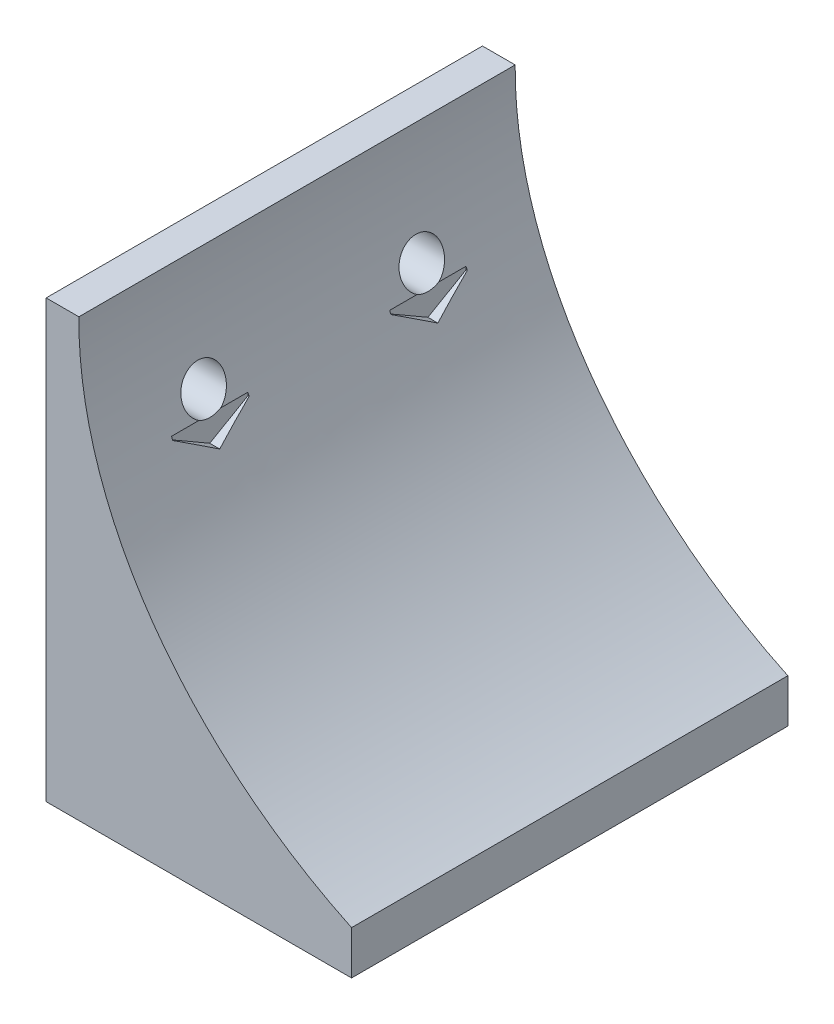
from build123d import *

# Parameters (mm, degrees)
EXTRUDE_1_DEPTH     = 20
SKETCH_2_R          = 2
CUT_EXTRUDE_2_DEPTH = 10
CUT_EXTRUDE_3_DEPTH = 20


with BuildPart() as part:
    # 草图1 → 凸台-拉伸1 (new, symmetric)
    with BuildSketch(Plane.XY):
        with BuildLine():
            Line((0, 40), (0, 0))
            Line((0, 0), (28, 0))
            Line((28, 0), (28, 4))
            add(Edge.make_bspline(
                [(28, 4), (14.27041689, 10.491058619), (2.887307451, 23.83674366), (3, 40)],
                knots=[0, 0, 0, 0, 1, 1, 1, 1], degree=3))
            Line((3, 40), (0, 40))
        make_face()
    extrude(amount=EXTRUDE_1_DEPTH, both=True)

    # 草图2 → 切除-拉伸2 (cut, symmetric)
    with BuildSketch(Plane(origin=(0, 0, 0), x_dir=(0, 0, -1), z_dir=(1, 0, 0))):
        with Locations((-10, 30)):
            Circle(SKETCH_2_R)
        with Locations((10, 30)):
            Circle(SKETCH_2_R)
    extrude(amount=CUT_EXTRUDE_2_DEPTH, both=True, mode=Mode.SUBTRACT)

    # 草图3 → 切除-拉伸3 (cut)
    with BuildSketch(Plane(origin=(5, 0, 0), x_dir=(0, 0, -1), z_dir=(1, 0, 0))):
        Polygon((-10, 34.041451884), (-13.5, 32.020725942), (-13.5, 27.979274058), (-10, 25.958548116), (-6.5, 27.979274058), (-6.5, 32.020725942), align=None)
        Polygon((10, 34.041451884), (6.5, 32.020725942), (6.5, 27.979274058), (10, 25.958548116), (13.5, 27.979274058), (13.5, 32.020725942), align=None)
    extrude(amount=CUT_EXTRUDE_3_DEPTH, mode=Mode.SUBTRACT)


solid = part.part
